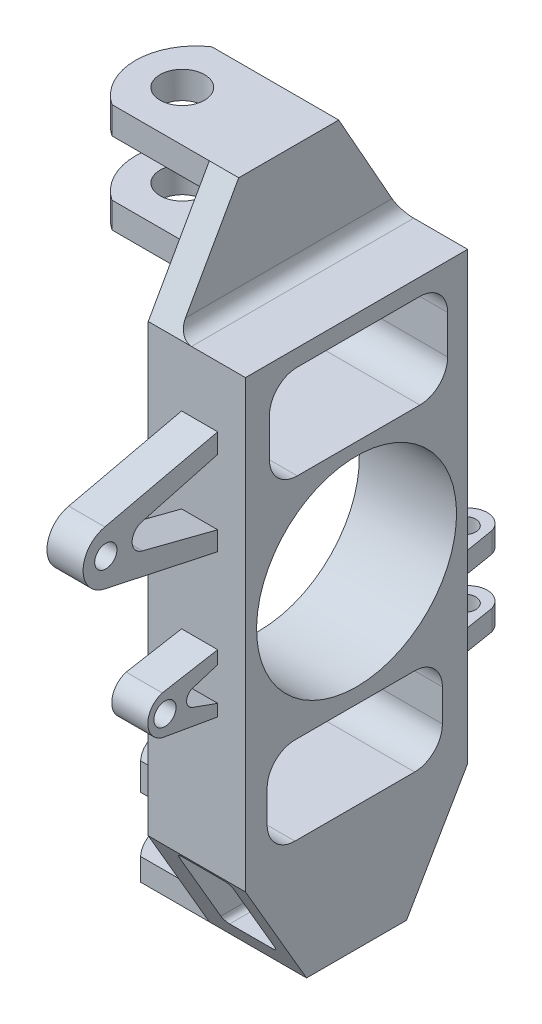
from build123d import *

# Parameters (mm, degrees)
BOSS_EXTRUDE1_DEPTH            = 40
CUT_EXTRUDE1_REACH             = 247.558
SKETCH3_R                      = 8
CUT_EXTRUDE1_DIRECTION_2_DEPTH = 246.557512105
CUT_EXTRUDE2_REACH             = 247.558
SKETCH5_R                      = 8
SKETCH7_R                      = 36
CUT_EXTRUDE3_DEPTH             = 35
SKETCH8_W                      = 21.604680843
SKETCH8_H                      = 11.583217502
SKETCH8_H_2                    = 12.576064717
BOSS_EXTRUDE3_DEPTH            = 32
CUT_EXTRUDE4_REACH             = 170.774
SKETCH9_R                      = 4
SKETCH10_W                     = 13
SKETCH10_H                     = 51.29710608
SKETCH10_H_2                   = 20.975155012
BOSS_EXTRUDE4_DEPTH            = 50
SKETCH11_R                     = 4
CUT_EXTRUDE5_DEPTH             = 50
CUT_EXTRUDE7_DEPTH             = 245.136802941
SKETCH15_W                     = 21.604680843
SKETCH15_H                     = 4.250308509
SKETCH15_H_2                   = 5.246064717
CUT_EXTRUDE8_DEPTH             = 32
CUT_EXTRUDE11_DEPTH            = 245.136802941
CUT_EXTRUDE12_DEPTH            = 245.136802941
SKETCH21_W                     = 24.416384629
SKETCH21_H                     = 39.106853427
CUT_EXTRUDE13_DEPTH            = 252.023351524
FILLET1_R                      = 5
SKETCH28_W                     = 19.48947631
SKETCH28_H                     = 29.692020957
CUT_EXTRUDE17_DEPTH            = 252.023351524
CUT_EXTRUDE19_DEPTH            = 40
CUT_EXTRUDE20_DEPTH            = 40
FILLET4_R                      = 2
CUT_EXTRUDE21_DEPTH            = 40
SKETCH35_W                     = 64.140186451
SKETCH35_H                     = 33.882408076
CUT_EXTRUDE25_DEPTH            = 241.633233856
FILLET5_R                      = 10
SKETCH36_W                     = 63.092398873
SKETCH36_H                     = 31.546199436
CUT_EXTRUDE26_DEPTH            = 241.633233856
FILLET6_R                      = 10
CUT_EXTRUDE27_DEPTH            = 258.924257322
CUT_EXTRUDE29_DEPTH            = 241.633233856
CUT_EXTRUDE32_DEPTH            = 241.633233856


with BuildPart() as part:
    # Sketch1 → Boss-Extrude1 (new, symmetric)
    with BuildSketch(Plane.XY):
        Polygon((48.795922062, 219.289035295), (48.795922062, -18.023943156), (-20.482716366, -18.023943156), (-20.482716366, -10), (13.795922062, -10), (13.795922062, 10), (-20.482716366, 10), (-20.482716366, 19.821446156), (13.795922062, 19.821446156), (13.795922062, 180.182181868), (-32.635756138, 180.182181868), (-32.635756138, 189.509917116), (13.795922062, 189.509917116), (13.795922062, 209.509917116), (-32.635756138, 209.509917116), (-32.635756138, 219.289035295), align=None)
    extrude(amount=BOSS_EXTRUDE1_DEPTH, both=True)

    # Cut-Extrude1: up to this face of the body (flat: up to its plane)
    cut_extrude1_end = Plane(part.part.faces().sort_by_distance((-9.419917038, 180.182181868, 0))[0])
    # Sketch3 → Cut-Extrude1 (cut, up to the picked face)
    with BuildSketch(Plane(origin=(0, 219.289035295, 0), x_dir=(1, 0, 0), z_dir=(0, 1, 0)), mode=Mode.PRIVATE) as cut_extrude1_sk1:
        with Locations(Location((-13.951092455, 0, 0), (0, 0, 180))):
            Circle(SKETCH3_R)
    cut_extrude1_tool1 = split(extrude(cut_extrude1_sk1.sketch, amount=-CUT_EXTRUDE1_REACH, mode=Mode.PRIVATE), bisect_by=cut_extrude1_end, keep=Keep.BOTH, mode=Mode.PRIVATE)
    add(cut_extrude1_tool1.solids().sort_by(Axis((-13.951092, 219.289035, 0), (0, -1, 0)))[0], mode=Mode.SUBTRACT)

    # Sketch3 → Cut-Extrude1 direction 2 (cut)
    with BuildSketch(Plane(origin=(0, 219.289035295, 0), x_dir=(1, 0, 0), z_dir=(0, 1, 0))):
        with Locations(Location((-13.951092455, 0, 0), (0, 0, 180))):
            Circle(SKETCH3_R)
    extrude(amount=CUT_EXTRUDE1_DIRECTION_2_DEPTH, mode=Mode.SUBTRACT)

    # Cut-Extrude2: up to this face of the body (flat: up to its plane)
    cut_extrude2_end = Plane(part.part.faces().sort_by_distance((-3.343397152, 19.821446156, 0))[0])
    # Sketch5 → Cut-Extrude2 (cut, up to the picked face)
    with BuildSketch(Plane(origin=(0, -18.023943156, 0), x_dir=(-1, 0, 0), z_dir=(0, -1, 0)), mode=Mode.PRIVATE) as cut_extrude2_sk1:
        with Locations(Location((0, 0, 0), (0, 0, 90))):
            Circle(SKETCH5_R)
    cut_extrude2_tool1 = split(extrude(cut_extrude2_sk1.sketch, amount=-CUT_EXTRUDE2_REACH, mode=Mode.PRIVATE), bisect_by=cut_extrude2_end, keep=Keep.BOTH, mode=Mode.PRIVATE)
    add(cut_extrude2_tool1.solids().sort_by(Axis((0, -18.023943, 0), (0, 1, 0)))[0], mode=Mode.SUBTRACT)

    # Sketch7 → Cut-Extrude3 (cut)
    with BuildSketch(Plane.ZY.offset(-13.795922062)):
        with Locations(Location((0, 99.754958558, 0), (0, 0, 270))):
            Circle(SKETCH7_R)
    extrude(amount=-CUT_EXTRUDE3_DEPTH, mode=Mode.SUBTRACT)

    # Sketch8 → Boss-Extrude3 (add)
    with BuildSketch(Plane(origin=(0, 0, -40), x_dir=(-1, 0, 0), z_dir=(0, 0, -1))):
        with Locations((-24.598262484, 68.861435207)):
            Rectangle(SKETCH8_W, SKETCH8_H)
        with Locations((-24.598262484, 39.903391451)):
            Rectangle(SKETCH8_W, SKETCH8_H_2)
    extrude(amount=BOSS_EXTRUDE3_DEPTH)

    # Cut-Extrude4: up to this face of the body (flat: up to its plane)
    cut_extrude4_end = Plane(part.part.faces().sort_by_distance((24.598262483, 33.615359093, -56))[0])
    # Sketch9 → Cut-Extrude4 (cut, up to the picked face)
    with BuildSketch(Plane(origin=(0, 74.653043958, 0), x_dir=(1, 0, 0), z_dir=(0, 1, 0)), mode=Mode.PRIVATE) as cut_extrude4_sk1:
        with Locations(Location((24.598262483, 63.091770197, 0), (0, 0, 270))):
            Circle(SKETCH9_R)
    cut_extrude4_tool1 = split(extrude(cut_extrude4_sk1.sketch, amount=-CUT_EXTRUDE4_REACH, mode=Mode.PRIVATE), bisect_by=cut_extrude4_end, keep=Keep.BOTH, mode=Mode.PRIVATE)
    add(cut_extrude4_tool1.solids().sort_by(Axis((24.598262, 74.653044, -63.09177), (0, -1, 0)))[0], mode=Mode.SUBTRACT)

    # Sketch10 → Boss-Extrude4 (add)
    with BuildSketch(Plane.XY.offset(40)):
        with Locations((32.303079831, 139.684536505)):
            Rectangle(SKETCH10_W, SKETCH10_H)
        with Locations((32.303079831, 79.86631507)):
            Rectangle(SKETCH10_W, SKETCH10_H_2)
    extrude(amount=BOSS_EXTRUDE4_DEPTH)

    # Sketch11 → Cut-Extrude5 (cut)
    with BuildSketch(Plane.ZY.offset(-25.803079831)):
        with Locations((80.287201061, 139.684536505)):
            Circle(SKETCH11_R)
        with Locations((58.979212318, 79.86631507)):
            Circle(SKETCH11_R)
    extrude(amount=-CUT_EXTRUDE5_DEPTH, mode=Mode.SUBTRACT)

    # Sketch14 → Cut-Extrude7 (cut, through all)
    with BuildSketch(Plane.ZY.offset(-25.803079831)):
        with BuildLine():
            Line((40, 90.353892576), (59.957148772, 86.844568036))
            ThreePointArc((59.957148772, 86.844568036), (65.158938112, 79.865441553), (59.957148772, 72.88631507))
            Line((59.957148772, 72.88631507), (40, 69.378737564))
            Line((40, 69.378737564), (90, 69.378737564))
            Line((90, 69.378737564), (90, 90.353892576))
            Line((90, 90.353892576), (40, 90.353892576))
        make_face()
    extrude(amount=-CUT_EXTRUDE7_DEPTH, mode=Mode.SUBTRACT)

    # Sketch15 → Cut-Extrude8 (cut)
    with BuildSketch(Plane(origin=(0, 0, -72), x_dir=(-1, 0, 0), z_dir=(0, 0, -1))):
        with Locations((-24.598262484, 72.527889703)):
            Rectangle(SKETCH15_W, SKETCH15_H)
        with Locations((-24.598262484, 36.238391452)):
            Rectangle(SKETCH15_W, SKETCH15_H_2)
    extrude(amount=-CUT_EXTRUDE8_DEPTH, mode=Mode.SUBTRACT)

    # Sketch19 → Cut-Extrude11 (cut, through all)
    with BuildSketch(Plane.ZY.offset(-25.803079831)):
        with BuildLine():
            Line((40, 151.248187017), (40, 127.742316887))
            Line((40, 127.742316887), (67.099908124, 134.719475081))
            ThreePointArc((67.099908124, 134.719475081), (70.80523062, 139.333510496), (67.099908124, 143.947545912))
            Line((67.099908124, 143.947545912), (40, 151.248187017))
        make_face()
        with BuildLine():
            Line((40, 85.691199656), (40, 73.635914702))
            Line((40, 73.635914702), (49.291876994, 76.957825363))
            ThreePointArc((49.291876994, 76.957825363), (51.194464474, 79.872437157), (49.291876994, 82.787048951))
            Line((49.291876994, 82.787048951), (40, 85.691199656))
        make_face()
    extrude(amount=-CUT_EXTRUDE11_DEPTH, mode=Mode.SUBTRACT)

    # Sketch20 → Cut-Extrude12 (cut, through all)
    with BuildSketch(Plane.ZY.offset(-25.803079831)):
        with BuildLine():
            Line((40, 158.290638281), (80.627121599, 148.943019033))
            ThreePointArc((80.627121599, 148.943019033), (88.467103267, 139.291446527), (80.659173946, 129.613925972))
            Line((80.659173946, 129.613925972), (40, 120.889150176))
            Line((40, 120.889150176), (40, 114.035983465))
            Line((40, 114.035983465), (90, 114.035983465))
            Line((90, 114.035983465), (90, 165.333089545))
            Line((90, 165.333089545), (40, 165.333089545))
            Line((40, 165.333089545), (40, 158.290638281))
        make_face()
    extrude(amount=-CUT_EXTRUDE12_DEPTH, mode=Mode.SUBTRACT)

    # Sketch21 → Cut-Extrude13 (cut, through all)
    with BuildSketch(Plane.XY.offset(40)):
        with Locations((36.587729748, 199.735608582)):
            Rectangle(SKETCH21_W, SKETCH21_H)
    extrude(amount=-CUT_EXTRUDE13_DEPTH, mode=Mode.SUBTRACT)

    # Fillet1
    fillet1_edges = [part.edges().sort_by_distance(p)[0] for p in [
        (24.379537433, 180.182181868, 0),
    ]]
    fillet(fillet1_edges, radius=FILLET1_R)

    # Sketch28 → Cut-Extrude17 (cut, through all)
    with BuildSketch(Plane.XY.offset(40)):
        with Locations((33.03525061, 4.024705442)):
            Rectangle(SKETCH28_W, SKETCH28_H)
    extrude(amount=-CUT_EXTRUDE17_DEPTH, mode=Mode.SUBTRACT)

    # Sketch30 → Cut-Extrude19 (cut)
    with BuildSketch(Plane.XZ.offset(18.023943156)):
        with BuildLine():
            Line((14.156602848, -40), (-10.332701858, -15.510695295))
            ThreePointArc((-10.332701858, -15.510695295), (-17.412694024, 1.581917814), (-10.332701858, 18.674530923))
            Line((-10.332701858, 18.674530923), (13.795922062, 40))
            Line((13.795922062, 40), (-20.482716366, 40))
            Line((-20.482716366, 40), (-20.482716366, -40))
            Line((-20.482716366, -40), (14.156602848, -40))
        make_face()
    extrude(amount=-CUT_EXTRUDE19_DEPTH, mode=Mode.SUBTRACT)

    # Sketch31 → Cut-Extrude20 (cut)
    with BuildSketch(Plane.XZ.offset(-180.182181868)):
        with BuildLine():
            Line((13.795922062, 40), (-21.279421272, 18))
            ThreePointArc((-21.279421272, 18), (-30.816200409, 0), (-21.279421272, -18))
            Line((-21.279421272, -18), (13.795922062, -40))
            Line((13.795922062, -40), (-32.635756138, -40))
            Line((-32.635756138, -40), (-32.635756138, 40))
            Line((-32.635756138, 40), (13.795922062, 40))
        make_face()
    extrude(amount=-CUT_EXTRUDE20_DEPTH, mode=Mode.SUBTRACT)

    # Fillet4
    fillet4_edges = [part.edges().sort_by_distance(p)[0] for p in [
        (23.290512455, 18.87071592, 0),
        (42.779988765, 18.87071592, 0),
        (42.779988765, -10.821305037, 0),
        (23.290512455, -10.821305037, 0),
    ]]
    fillet(fillet4_edges, radius=FILLET4_R)

    # Sketch32 → Cut-Extrude21 (cut)
    with BuildSketch(Plane(origin=(0, 70.402735449, 0), x_dir=(1, 0, 0), z_dir=(0, 1, 0))):
        with BuildLine():
            Line((13.795922062, 40), (18.098262483, 66.377334942))
            ThreePointArc((18.098262483, 66.377334942), (24.598262483, 71.24906176), (31.098262483, 66.377334942))
            Line((31.098262483, 66.377334942), (35.400602905, 40))
            Line((35.400602905, 40), (35.400602905, 72))
            Line((35.400602905, 72), (13.795922062, 72))
            Line((13.795922062, 72), (13.795922062, 40))
        make_face()
    extrude(amount=-CUT_EXTRUDE21_DEPTH, mode=Mode.SUBTRACT)

    # Sketch35 → Cut-Extrude25 (cut, through all)
    with BuildSketch(Plane.ZY.offset(-13.795922062)):
        with Locations((-0.729083146, 157.159788045)):
            Rectangle(SKETCH35_W, SKETCH35_H)
    extrude(amount=-CUT_EXTRUDE25_DEPTH, mode=Mode.SUBTRACT)

    # Fillet5
    fillet5_edges = [part.edges().sort_by_distance(p)[0] for p in [
        (31.295922062, 140.218584007, -32.799176371),
        (31.295922062, 174.100992083, -32.799176371),
        (31.295922062, 174.100992083, 31.34101008),
        (31.295922062, 140.218584007, 31.34101008),
    ]]
    fillet(fillet5_edges, radius=FILLET5_R)

    # Sketch36 → Cut-Extrude26 (cut, through all)
    with BuildSketch(Plane.ZY.offset(-13.795922062)):
        with Locations((0.639461373, 42.521126055)):
            Rectangle(SKETCH36_W, SKETCH36_H)
    extrude(amount=-CUT_EXTRUDE26_DEPTH, mode=Mode.SUBTRACT)

    # Fillet6
    fillet6_edges = [part.edges().sort_by_distance(p)[0] for p in [
        (31.295922062, 26.748026337, -30.906738064),
        (31.295922062, 58.294225773, -30.906738064),
        (31.295922062, 58.294225773, 32.185660809),
        (31.295922062, 26.748026337, 32.185660809),
    ]]
    fillet(fillet6_edges, radius=FILLET6_R)

    # Sketch37 → Cut-Extrude27 (cut, through all)
    with BuildSketch(Plane(origin=(0, 219.289035295, 0), x_dir=(1, 0, 0), z_dir=(0, 1, 0))):
        Polygon((-21.279421272, 18), (13.795922062, 18), (13.795922062, 40), align=None)
        Polygon((-21.279421272, -18), (13.795922062, -18), (13.795922062, -40), align=None)
    extrude(amount=-CUT_EXTRUDE27_DEPTH, mode=Mode.SUBTRACT)

    # Sketch38 → Cut-Extrude29 (cut, through all)
    with BuildSketch(Plane.ZY.offset(-13.795922062)):
        Polygon((-40, 180.182181868), (-40, 219.289035295), (-18, 219.289035295), align=None)
        Polygon((40, 180.182181868), (40, 219.289035295), (18, 219.289035295), align=None)
    extrude(amount=-CUT_EXTRUDE29_DEPTH, mode=Mode.SUBTRACT)

    # Sketch39 → Cut-Extrude32 (cut, through all)
    with BuildSketch(Plane.ZY.offset(-13.795922062)):
        Polygon((40, 19.821446156), (40, -18.023943156), (18, -18.023943156), align=None)
        Polygon((-18, -18.023943156), (-40, -18.023943156), (-40, 19.821446156), align=None)
    extrude(amount=-CUT_EXTRUDE32_DEPTH, mode=Mode.SUBTRACT)


solid = part.part
